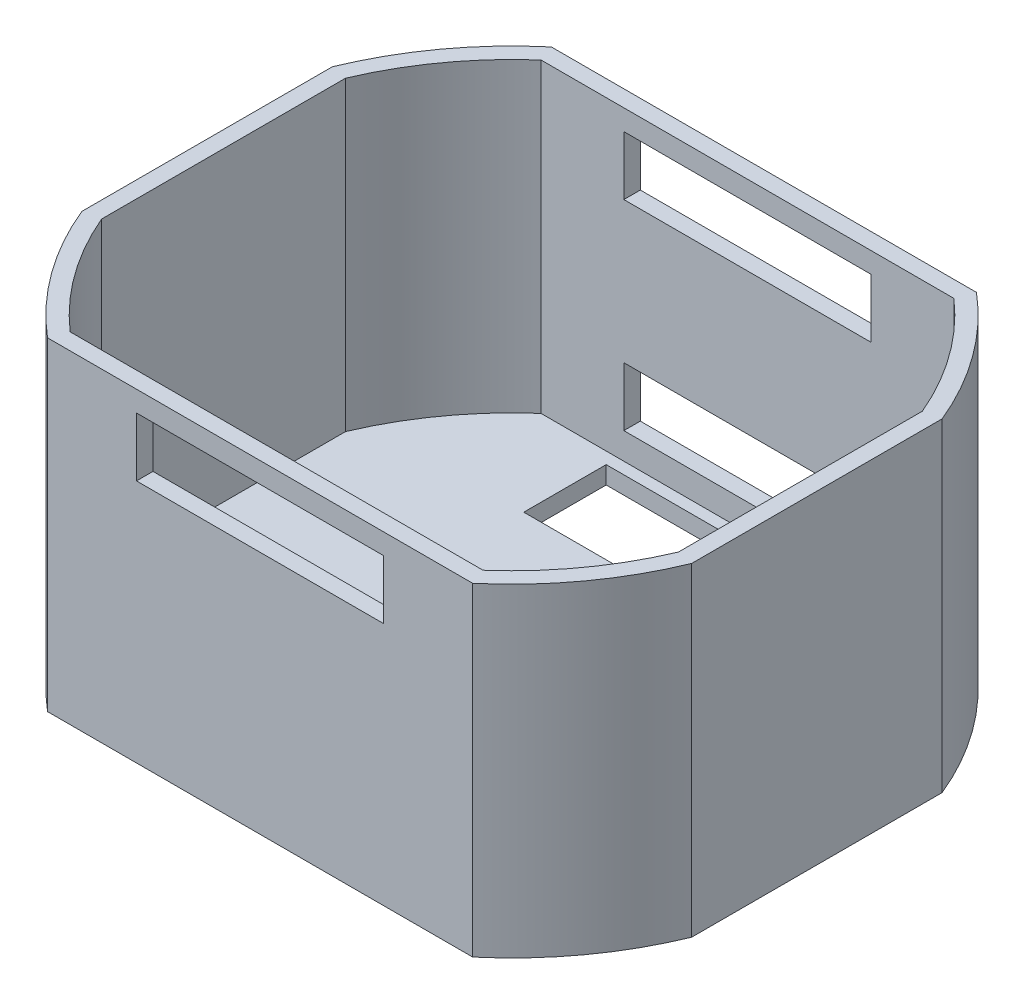
from build123d import *

# Parameters (mm, degrees)
BOSS_EXTRUDE1_DEPTH     = 13.75
CUT_EXTRUDE1_DEPTH      = 51.732952802
CUT_EXTRUDE1_DEPTH_BACK = 51.732952802
SKETCH2_W               = 21
SKETCH2_H               = 5
BOSS_EXTRUDE2_START     = -1.5
BOSS_EXTRUDE2_DEPTH     = 1.5
SKETCH4_W               = 21
SKETCH4_H               = 5
CUT_EXTRUDE2_DEPTH      = 2
SKETCH5_W               = 22
SKETCH5_H               = 7
CUT_EXTRUDE3_DEPTH      = 2


with BuildPart() as part:
    # Sketch1 → Boss-Extrude1 (new, symmetric)
    with BuildSketch(Plane(origin=(0, 0, 0), x_dir=(1, 0, 0), z_dir=(0, 1, 0))):
        with BuildLine():
            Line((-18.056577749, 21.4), (18.056577749, 21.4))
            ThreePointArc((18.056577749, 21.4), (22.627296293, 16.492588107), (25.9, 10.639078907))
            Line((25.9, 10.639078907), (25.9, -10.639078907))
            ThreePointArc((25.9, -10.639078907), (22.627296293, -16.492588107), (18.056577749, -21.4))
            Line((18.056577749, -21.4), (-18.056577749, -21.4))
            ThreePointArc((-18.056577749, -21.4), (-22.627296293, -16.492588107), (-25.9, -10.639078907))
            Line((-25.9, -10.639078907), (-25.9, 10.639078907))
            ThreePointArc((-25.9, 10.639078907), (-22.627296293, 16.492588107), (-18.056577749, 21.4))
        make_face()
        with BuildLine():
            Line((-17.537388631, 20), (17.537388631, 20))
            ThreePointArc((17.537388631, 20), (21.564379672, 15.573616451), (24.5, 10.359054011))
            Line((24.5, 10.359054011), (24.5, -10.359054011))
            ThreePointArc((24.5, -10.359054011), (21.564379672, -15.573616451), (17.537388631, -20))
            Line((17.537388631, -20), (-17.537388631, -20))
            ThreePointArc((-17.537388631, -20), (-21.564379672, -15.573616451), (-24.5, -10.359054011))
            Line((-24.5, -10.359054011), (-24.5, 10.359054011))
            ThreePointArc((-24.5, 10.359054011), (-21.564379672, 15.573616451), (-17.537388631, 20))
        make_face(mode=Mode.SUBTRACT)
    extrude(amount=BOSS_EXTRUDE1_DEPTH, both=True)

    # Sketch2 → Cut-Extrude1 (cut, two sides: drawn at the far end of the back side and taken through both)
    with BuildSketch(Plane.XY.offset(-20).offset(-CUT_EXTRUDE1_DEPTH_BACK)):
        with Locations((0, 9.5)):
            Rectangle(SKETCH2_W, SKETCH2_H)
    extrude(amount=CUT_EXTRUDE1_DEPTH + CUT_EXTRUDE1_DEPTH_BACK, mode=Mode.SUBTRACT)

    # Sketch3 → Boss-Extrude2 (add)
    with BuildSketch(Plane.XZ.offset(13.75).offset(BOSS_EXTRUDE2_START)):
        with BuildLine():
            Line((-18.056577749, -21.4), (18.056577749, -21.4))
            ThreePointArc((18.056577749, -21.4), (22.627296293, -16.492588107), (25.9, -10.639078907))
            Line((25.9, -10.639078907), (25.9, 10.639078907))
            ThreePointArc((25.9, 10.639078907), (22.627296293, 16.492588107), (18.056577749, 21.4))
            Line((18.056577749, 21.4), (-18.056577749, 21.4))
            ThreePointArc((-18.056577749, 21.4), (-22.627296293, 16.492588107), (-25.9, 10.639078907))
            Line((-25.9, 10.639078907), (-25.9, -10.639078907))
            ThreePointArc((-25.9, -10.639078907), (-22.627296293, -16.492588107), (-18.056577749, -21.4))
        make_face()
    extrude(amount=BOSS_EXTRUDE2_DEPTH)

    # Sketch4 → Cut-Extrude2 (cut)
    with BuildSketch(Plane(origin=(0, 0, -21.4), x_dir=(-1, 0, 0), z_dir=(0, 0, -1))):
        with Locations((0, -7.5)):
            Rectangle(SKETCH4_W, SKETCH4_H)
    extrude(amount=-CUT_EXTRUDE2_DEPTH, mode=Mode.SUBTRACT)

    # Sketch5 → Cut-Extrude3 (cut)
    with BuildSketch(Plane(origin=(0, -12.25, 0), x_dir=(-1, 0, 0), z_dir=(0, 1, 0))):
        with Locations((0, -15.5)):
            Rectangle(SKETCH5_W, SKETCH5_H)
    extrude(amount=-CUT_EXTRUDE3_DEPTH, mode=Mode.SUBTRACT)


solid = part.part
